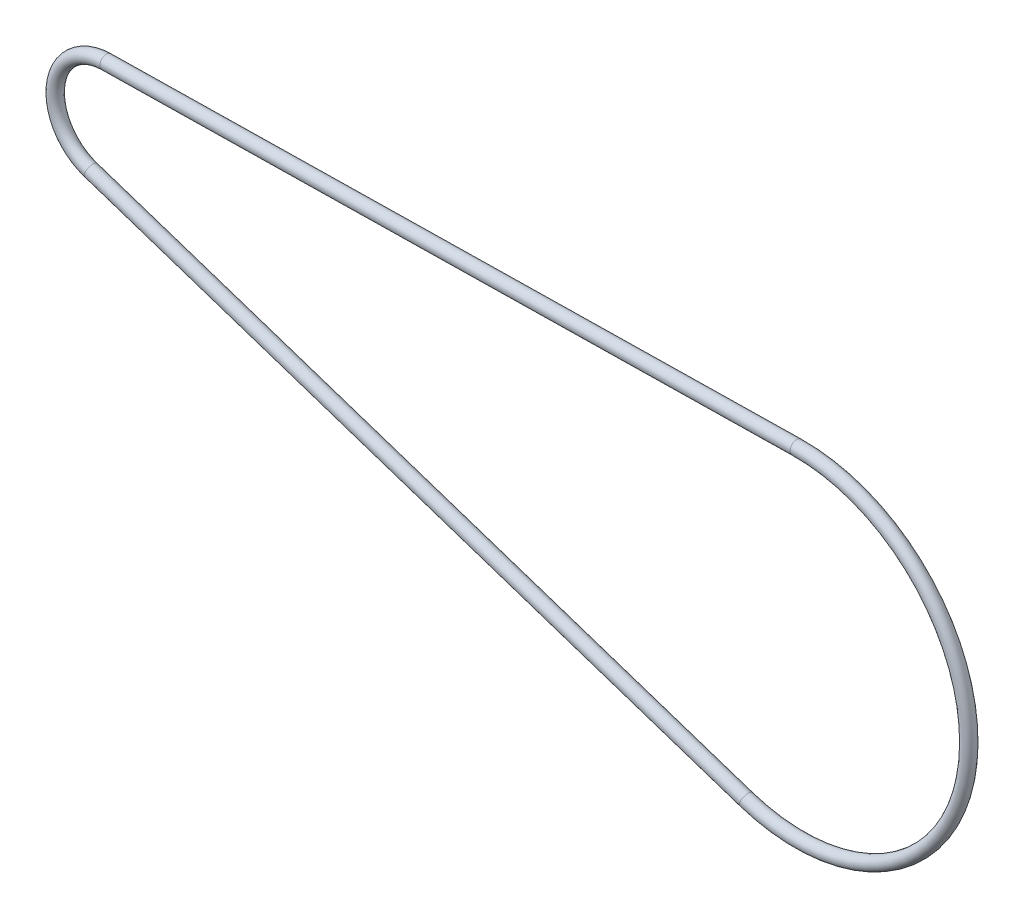
from build123d import *

# Parameters (mm, degrees)
CADENA_PROFILE_R = 4


with BuildPart() as part:
    # Cadena: sweep along a path in Sk_Cadena
    with BuildLine(Plane.XY.offset(43.5)) as cadena_path:
        Line((-32.709812925, -98.722176528), (-435.164557823, 34.623945684))
        ThreePointArc((-435.164557823, 34.623945684), (-456.732354256, 69.836751415), (-425.62759993, 96.995650303))
        Line((-425.62759993, 96.995650303), (-1.714699773, 103.985863485))
        ThreePointArc((-1.714699773, 103.985863485), (102.80515133, -15.719442099), (-32.709812925, -98.722176528))
    # Cadena profile (on start of the path) → Cadena (sweep)
    with BuildSketch(Plane(origin=(-32.709812925, -98.722176528, 43.5), x_dir=(-0.314517431968955, -0.9492516973846578, 0), z_dir=(-0.9492516973846578, 0.314517431968955, 0))):
        Circle(CADENA_PROFILE_R)
    sweep(path=cadena_path.line)


solid = part.part
